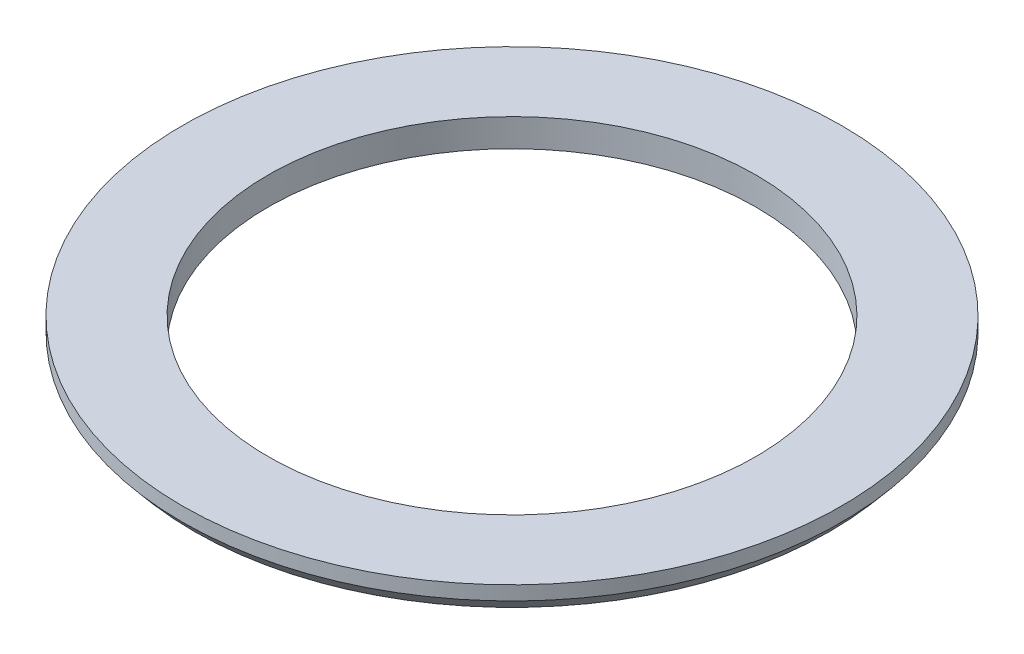
from build123d import *


with BuildPart() as part:
    # Çizim1 → Döndür1 (revolve)
    with BuildSketch(Plane.XY, mode=Mode.PRIVATE) as d_nd_r1_sk:
        Polygon((12.76, 0), (16.628153257, 0.000378215), (17.23887865, 0.723926381), (17.238806952, 1.457213446), (12.759857561, 1.45677551), align=None)
    revolve(d_nd_r1_sk.sketch.rotate(Axis((0, 0, 0), (0, 1, 0)), 90), axis=Axis((0, 0, 0), (0, 1, 0)))


solid = part.part
